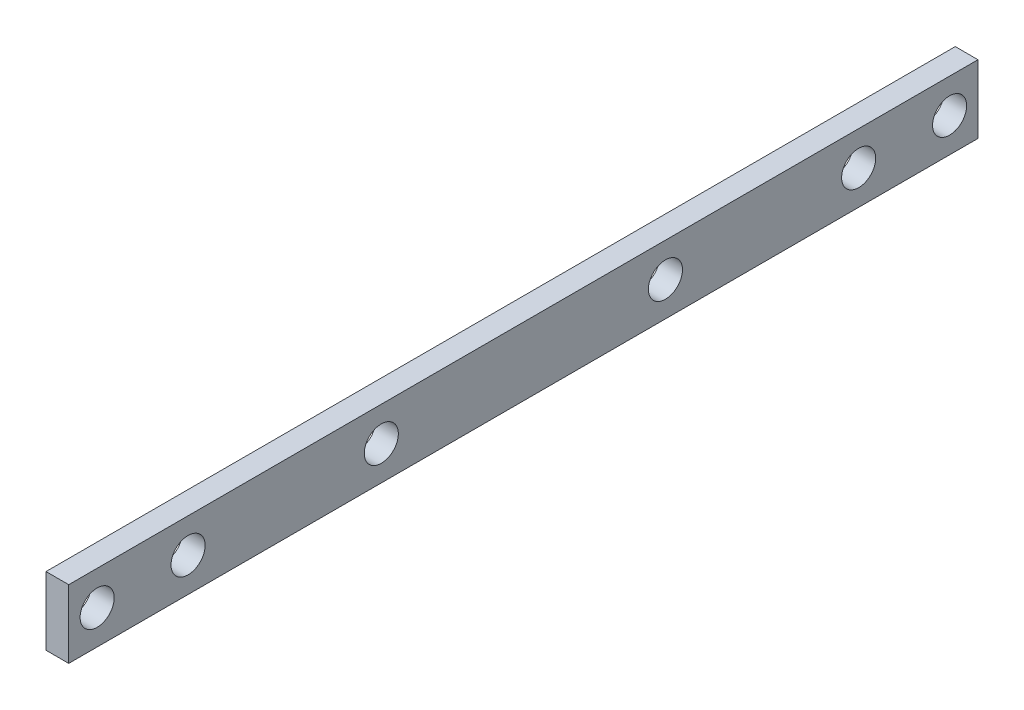
from build123d import *

# Parameters (mm, degrees)
SKETCH_1_W      = 80
SKETCH_1_H      = 6
SKETCH_1_R      = 1.5
EXTRUDE_1_DEPTH = 2


with BuildPart() as part:
    # 草图1 → 凸台-拉伸1 (new body)
    with BuildSketch(Plane(origin=(0, 0, 0), x_dir=(0, 0, -1), z_dir=(1, 0, 0))):
        Rectangle(SKETCH_1_W, SKETCH_1_H)
        with Locations((-37.5, 0)):
            Circle(SKETCH_1_R, mode=Mode.SUBTRACT)
        with Locations((-12.5, 0)):
            Circle(SKETCH_1_R, mode=Mode.SUBTRACT)
        with Locations((12.5, 0)):
            Circle(SKETCH_1_R, mode=Mode.SUBTRACT)
        with Locations((37.5, 0)):
            Circle(SKETCH_1_R, mode=Mode.SUBTRACT)
        with Locations((-29.5, 0)):
            Circle(SKETCH_1_R, mode=Mode.SUBTRACT)
        with Locations((29.5, 0)):
            Circle(SKETCH_1_R, mode=Mode.SUBTRACT)
    extrude(amount=EXTRUDE_1_DEPTH)


solid = part.part
